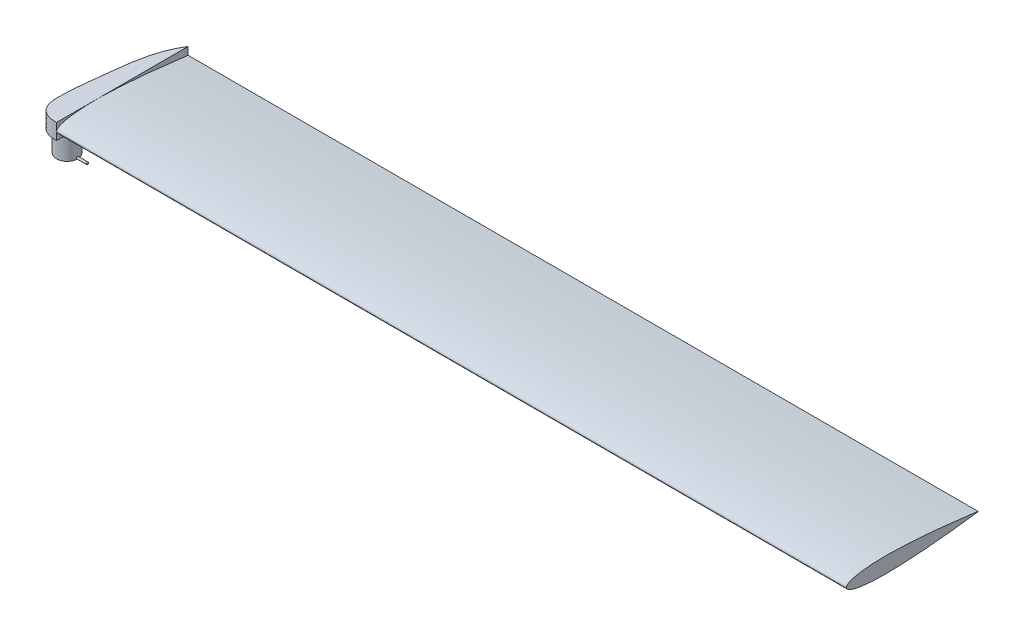
from build123d import *

# Parameters (mm, degrees)
BOSS_EXTRUDE1_DEPTH                  = 750
BOSS_EXTRUDE2_DEPTH                  = 15
SKETCH3_R                            = 10
BOSS_EXTRUDE4_DEPTH                  = 25
SKETCH4_R                            = 1
BOSS_EXTRUDE5_DEPTH                  = 9.5
BOSS_EXTRUDE5_DIRECTION_2_REACH      = 762.756
BOSS_EXTRUDE5_DIRECTION_2_END_RADIUS = 10


with BuildPart() as part:
    # Sketch1 → Boss-Extrude1 (new body)
    with BuildSketch(Plane(origin=(0, 0, 0), x_dir=(0, 0, -1), z_dir=(1, 0, 0))):
        with BuildLine():
            Line((124.995841149, 7.69748541), (124.995841149, 7.355117962))
            add(Edge.make_bspline(
                [(124.995841149, 7.69748541), (121.54944134, 8.132970798), (115.70786567, 8.871109432), (106.612829463, 10.001168496), (98.776677449, 10.90008096), (91.010430983, 11.718079743), (84.466171166, 12.374421583), (77.123127033, 13.01089191), (70.096902966, 13.661558661), (63.232186969, 14.038262432), (56.951183357, 14.458646485), (50.183054312, 14.744779284), (43.713149432, 14.928847728), (38.016747366, 14.98676945), (31.867108518, 14.964167357), (25.961108401, 14.764171889), (20.418478368, 14.31892281), (16.080893919, 13.902077279), (11.948417441, 13.276680513), (7.872022134, 12.438747868), (4.55145991, 11.481590763), (1.935078283, 10.189615691), (0.419790589, 8.867752598), (-0.116328202, 7.676448045), (0.228543289, 6.575716308), (1.092059769, 5.382828043), (3.121329832, 4.182675807), (5.833945868, 3.122360161), (8.969424846, 2.338039739), (12.454934448, 1.635555066), (16.398041291, 1.057622245), (20.40737347, 0.619305342), (24.940496845, 0.318514105), (28.9969109, 0.097914693), (33.640357675, 0.064950819), (37.619824838, -0.008774002), (42.130231161, 0.0151669), (46.825478609, 0.12809962), (52.059229259, 0.308197083), (57.570273171, 0.566048003), (63.06655694, 0.903534981), (68.78158744, 1.273560104), (74.2410514, 1.701195853), (79.332078991, 2.13196813), (83.765135248, 2.525837795), (88.333862548, 3.014972175), (93.451881908, 3.495491212), (98.448514928, 4.030663182), (103.359945306, 4.559670893), (107.534749069, 5.051051401), (112.036034411, 5.652589328), (116.898948088, 6.205114514), (121.185254011, 6.89818955), (124.034905271, 7.135577505), (124.871587069, 7.326730223), (124.995841149, 7.355117962)],
                knots=[0, 0, 0, 0, 0.040909693, 0.069341075, 0.107932085, 0.133795715, 0.161307297, 0.185385504, 0.220597866, 0.244393633, 0.266343568, 0.294730889, 0.324163188, 0.342565083, 0.361815516, 0.396586444, 0.412117028, 0.427295281, 0.44789639, 0.461301181, 0.476284913, 0.488528163, 0.495261637, 0.499815717, 0.502760785, 0.508369898, 0.516837026, 0.529992215, 0.542688859, 0.55481219, 0.571870003, 0.589595674, 0.60229618, 0.625369139, 0.637420541, 0.65697654, 0.672241267, 0.69053398, 0.712285021, 0.733912638, 0.755503976, 0.777133729, 0.801356586, 0.819993044, 0.837303591, 0.853766864, 0.874103184, 0.897840615, 0.912945775, 0.932278219, 0.947341947, 0.966428856, 0.989896213, 0.998499505, 1, 1, 1, 1], degree=3))
        make_face()
    extrude(amount=BOSS_EXTRUDE1_DEPTH)

    # Sketch2 → Boss-Extrude2 (add)
    with BuildSketch(Plane(origin=(0, 0, 0), x_dir=(1, 0, 0), z_dir=(0, 1, 0))):
        with BuildLine():
            Line((0, 124.995841149), (0, -0.000123715))
            add(Edge.make_bspline(
                [(0, -0.000123715), (-19.650012377, -0.338073724), (-20, 19.999876285)],
                knots=[0, 0, 0, 1, 1, 1], degree=2))
            add(Edge.make_bspline(
                [(-20, 19.999876285), (-20.256491221, 33.605237108), (-15.141746561, 69.220975098), (-12.666672021, 105.011543662), (0, 124.995841149)],
                knots=[0, 0, 0, 0, 0.363918555, 1, 1, 1, 1], degree=3))
        make_face()
    extrude(amount=BOSS_EXTRUDE2_DEPTH)

    # Sketch3 → Boss-Extrude4 (add)
    with BuildSketch(Plane.XZ):
        with Locations(Location((-10, -19.999876285, 0), (0, 0, 177.405061506))):
            Circle(SKETCH3_R)
    extrude(amount=BOSS_EXTRUDE4_DEPTH)

    # Sketch4 → Boss-Extrude5 (add)
    with BuildSketch(Plane(origin=(0, 0, 0), x_dir=(0, 0, -1), z_dir=(1, 0, 0))):
        with Locations(Location((19.999876285, -24, 0), (0, 0, 90.00000003))):
            Circle(SKETCH4_R)
    extrude(amount=BOSS_EXTRUDE5_DEPTH)

    # Boss-Extrude5 direction 2: up to this cylinder (the profile starts outside it)
    boss_extrude5_direction_2_end = Plane(origin=(-10, -24, -19.999876285), z_dir=(0, 1, 0)) * Cylinder(BOSS_EXTRUDE5_DIRECTION_2_END_RADIUS, 1546.512, mode=Mode.PRIVATE)
    # Sketch4 → Boss-Extrude5 direction 2 (add, up to the surface)
    with BuildSketch(Plane(origin=(0, 0, 0), x_dir=(0, 0, -1), z_dir=(1, 0, 0)), mode=Mode.PRIVATE) as boss_extrude5_direction_2_sk1:
        with Locations(Location((19.999876285, -24, 0), (0, 0, 90.00000003))):
            Circle(SKETCH4_R)
    boss_extrude5_direction_2_tool1 = extrude(boss_extrude5_direction_2_sk1.sketch, amount=-BOSS_EXTRUDE5_DIRECTION_2_REACH, mode=Mode.PRIVATE) - boss_extrude5_direction_2_end
    add(boss_extrude5_direction_2_tool1.solids().sort_by_distance((0, -24, -19.999876))[0])
    add(boss_extrude5_direction_2_tool1.solids().sort_by_distance((0, -24, -19.999876))[1])


solid = part.part
